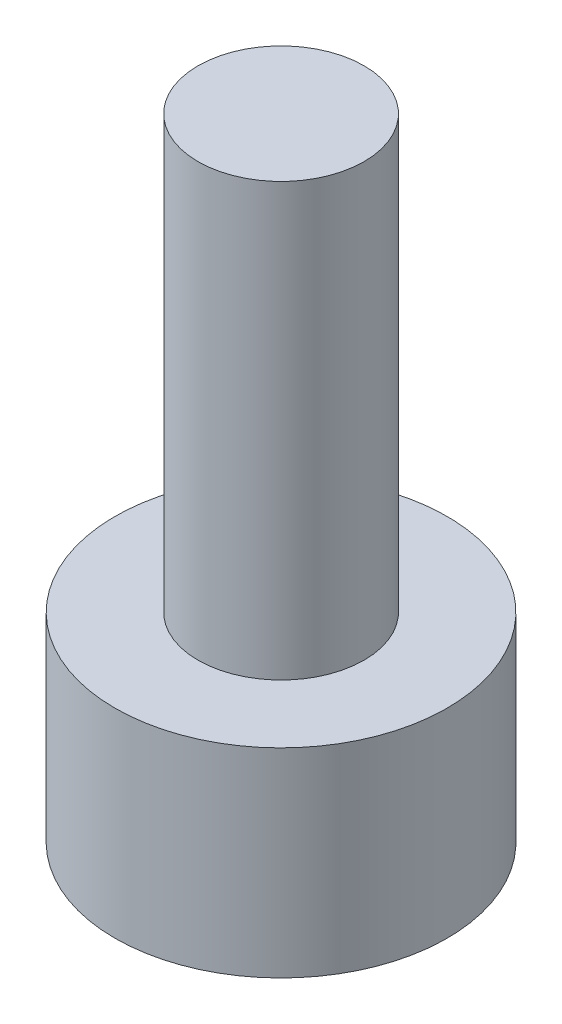
from build123d import *

# Parameters (mm, degrees)
SKETCH2_R           = 5
SKETCH2_R_2         = 2.5
BOSS_EXTRUDE1_DEPTH = 6
BOSS_EXTRUDE2_START = 6
SKETCH2_3_R         = 2.5
BOSS_EXTRUDE2_DEPTH = 13


with BuildPart() as part:
    # Sketch2 → Boss-Extrude1 (new body)
    # profile 1 of 2: a face of its own
    with BuildSketch(Plane(origin=(0, 0, 0), x_dir=(1, 0, 0), z_dir=(0, 1, 0))):
        with Locations(Location((0, 0, 0), (0, 0, 270))):
            Circle(SKETCH2_R)
        Circle(SKETCH2_R_2, mode=Mode.SUBTRACT)
    # profile 2 of 2: a face of its own
    with BuildSketch(Plane(origin=(0, 0, 0), x_dir=(1, 0, 0), z_dir=(0, 1, 0))):
        Circle(SKETCH2_R_2)
    extrude(amount=BOSS_EXTRUDE1_DEPTH)

    # Sketch2<3> → Boss-Extrude2 (add)
    with BuildSketch(Plane(origin=(0, 0, 0), x_dir=(1, 0, 0), z_dir=(0, 1, 0)).offset(BOSS_EXTRUDE2_START)):
        with Locations(Location((0, 0, 0), (0, 0, 90))):
            Circle(SKETCH2_3_R)
    extrude(amount=BOSS_EXTRUDE2_DEPTH)


solid = part.part
